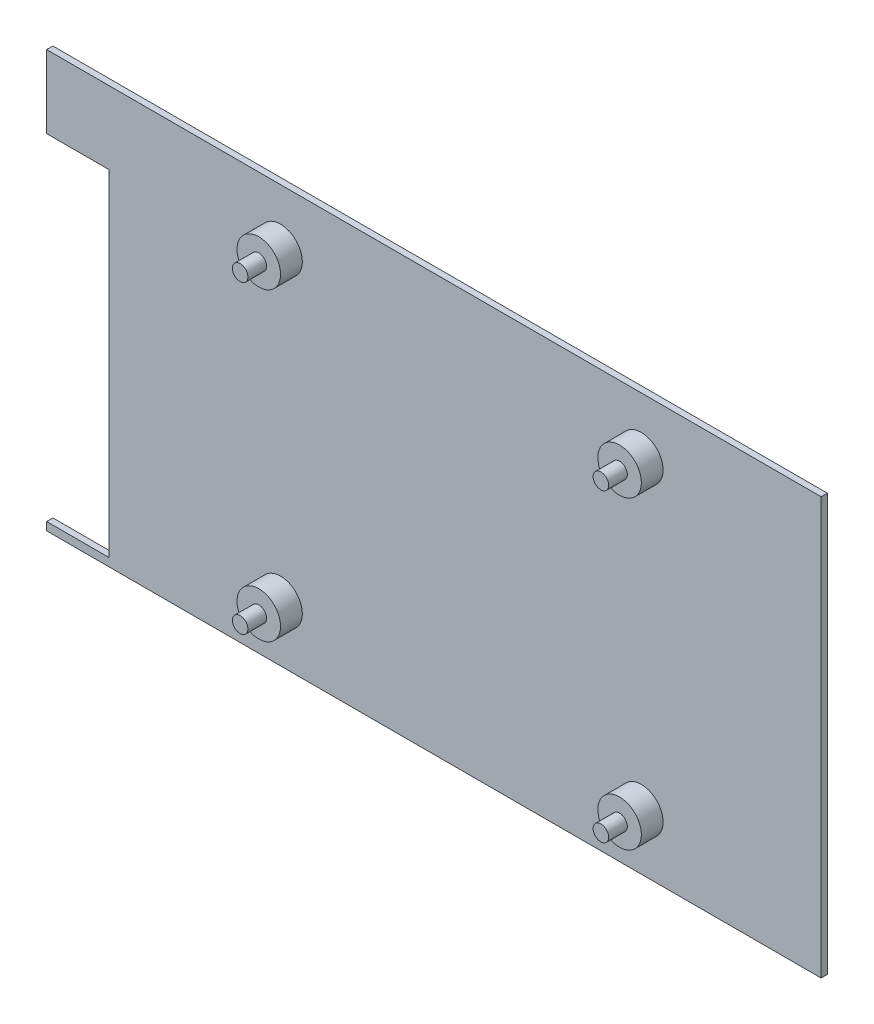
from build123d import *

# Parameters (mm, degrees)
BOSS_EXTRUDE1_DEPTH = 1
SKETCH2_R           = 3.5
BOSS_EXTRUDE2_DEPTH = 3.5
SKETCH3_R           = 1.25
BOSS_EXTRUDE3_DEPTH = 3


with BuildPart() as part:
    # Sketch1 → Boss-Extrude1 (new body)
    with BuildSketch(Plane.XY):
        Polygon((-61.85, 33.5), (-61.85, 21.8), (-51.85, 21.8), (-51.85, -32.2), (-61.85, -32.2), (-61.85, -33.5), (62.65, -33.5), (62.65, 33.5), align=None)
    extrude(amount=BOSS_EXTRUDE1_DEPTH)

    # Sketch2 → Boss-Extrude2 (add)
    with BuildSketch(Plane.XY.offset(1)):
        with Locations(Location((-24.25, 24.5, 0), (0, 0, 180))):
            Circle(SKETCH2_R)
        with Locations(Location((33.75, 24.5, 0), (0, 0, 180))):
            Circle(SKETCH2_R)
        with Locations(Location((33.75, -24.5, 0), (0, 0, 180))):
            Circle(SKETCH2_R)
        with Locations(Location((-24.25, -24.5, 0), (0, 0, 180))):
            Circle(SKETCH2_R)
    extrude(amount=BOSS_EXTRUDE2_DEPTH)

    # Sketch3 → Boss-Extrude3 (add)
    with BuildSketch(Plane.XY.offset(4.5)):
        with Locations((-24.25, 24.5)):
            Circle(SKETCH3_R)
        with Locations((33.75, 24.5)):
            Circle(SKETCH3_R)
        with Locations((33.75, -24.5)):
            Circle(SKETCH3_R)
        with Locations((-24.25, -24.5)):
            Circle(SKETCH3_R)
    extrude(amount=BOSS_EXTRUDE3_DEPTH)


solid = part.part
